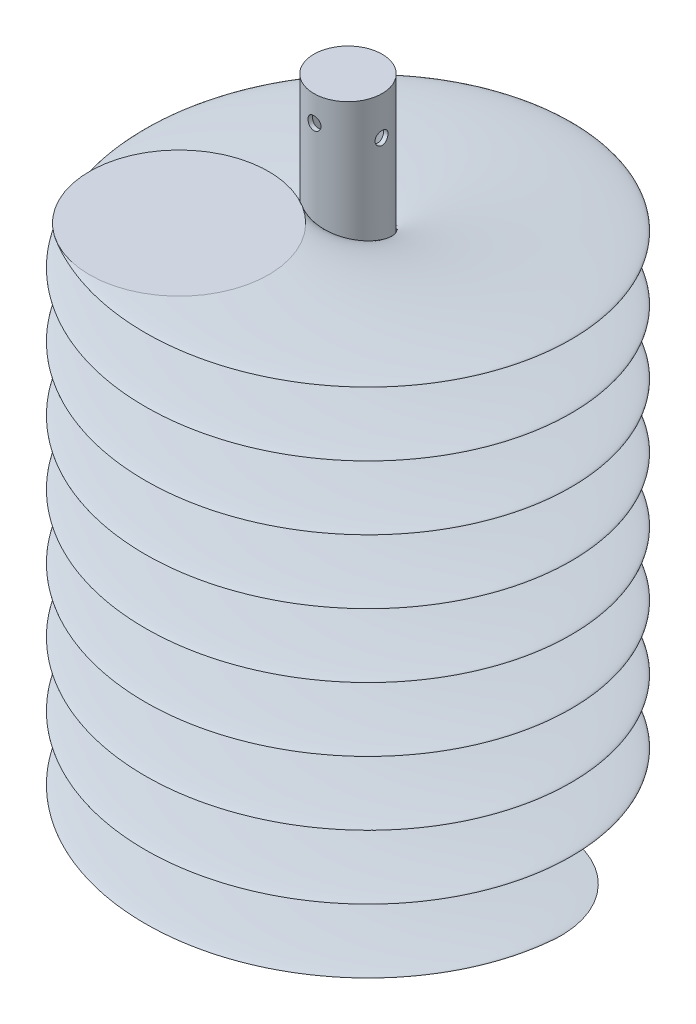
from build123d import *

# Parameters (mm, degrees)
SKETCH_1_R               = 16
EXTRUDE_1_DEPTH          = 300
SWEEP_2_PITCH            = 30
SWEEP_2_HEIGHT           = 250
SWEEP_2_RADIUS           = 16
SWEEP_2_START_ANGLE      = -90
SKETCH_9_R               = 42
SKETCH_12_R              = 14
CUT_EXTRUDE_1_DEPTH      = 296
CUT_EXTRUDE_2_DEPTH      = 332.662484763
CUT_EXTRUDE_2_DEPTH_BACK = 332.662484763
SKETCH_14_R              = 3.05
CUT_EXTRUDE_3_DEPTH      = 332.662484853
CUT_EXTRUDE_3_DEPTH_BACK = 332.662484853
SKETCH_15_R              = 3.05


with BuildPart() as part:
    # 草图1 → 凸台-拉伸1 (new body)
    with BuildSketch(Plane(origin=(0, 0, 0), x_dir=(1, 0, 0), z_dir=(0, 1, 0))):
        with Locations(Location((0, 0, 0), (0, 0, 270))):
            Circle(SKETCH_1_R)
    extrude(amount=EXTRUDE_1_DEPTH)

    # 草图12 → 切除-拉伸1 (cut)
    with BuildSketch(Plane(origin=(0, 2, 0), x_dir=(1, 0, 0), z_dir=(0, 1, 0))):
        with Locations(Location((0, 0, 0), (0, 0, 270))):
            Circle(SKETCH_12_R)
    extrude(amount=CUT_EXTRUDE_1_DEPTH, mode=Mode.SUBTRACT)

    # 草图14 → 切除-拉伸2 (cut, two sides: drawn at the far end of the back side and taken through both)
    with BuildSketch(Plane.XY.offset(-CUT_EXTRUDE_2_DEPTH_BACK)):
        with Locations((0, 288)):
            Circle(SKETCH_14_R)
    extrude(amount=CUT_EXTRUDE_2_DEPTH + CUT_EXTRUDE_2_DEPTH_BACK, mode=Mode.SUBTRACT)

    # 草图15 → 切除-拉伸3 (cut, two sides: drawn at the far end of the back side and taken through both)
    with BuildSketch(Plane.YZ.offset(-CUT_EXTRUDE_3_DEPTH_BACK)):
        with Locations(Location((282, 0, 0), (0, 0, 270))):
            Circle(SKETCH_15_R)
    extrude(amount=CUT_EXTRUDE_3_DEPTH + CUT_EXTRUDE_3_DEPTH_BACK, mode=Mode.SUBTRACT)


with BuildPart() as body_2:
    # 扫描2: sweep along a helix
    with BuildLine() as sweep_2_path:
        add(Helix(SWEEP_2_PITCH, SWEEP_2_HEIGHT, SWEEP_2_RADIUS, center=(0, 0, 0), direction=(0, 1, 0), lefthand=True, mode=Mode.PRIVATE).rotate(Axis((0, 0, 0), (0, 1, 0)), SWEEP_2_START_ANGLE))
    # 草图9 → 扫描2 (sweep)
    with BuildSketch(Plane(origin=(0, 0, 0), x_dir=(1, 0, 0), z_dir=(0, 1, 0))):
        with Locations((58, 0)):
            Circle(SKETCH_9_R)
    sweep(path=sweep_2_path.line, is_frenet=True)


solid = Compound([part.part, body_2.part])
